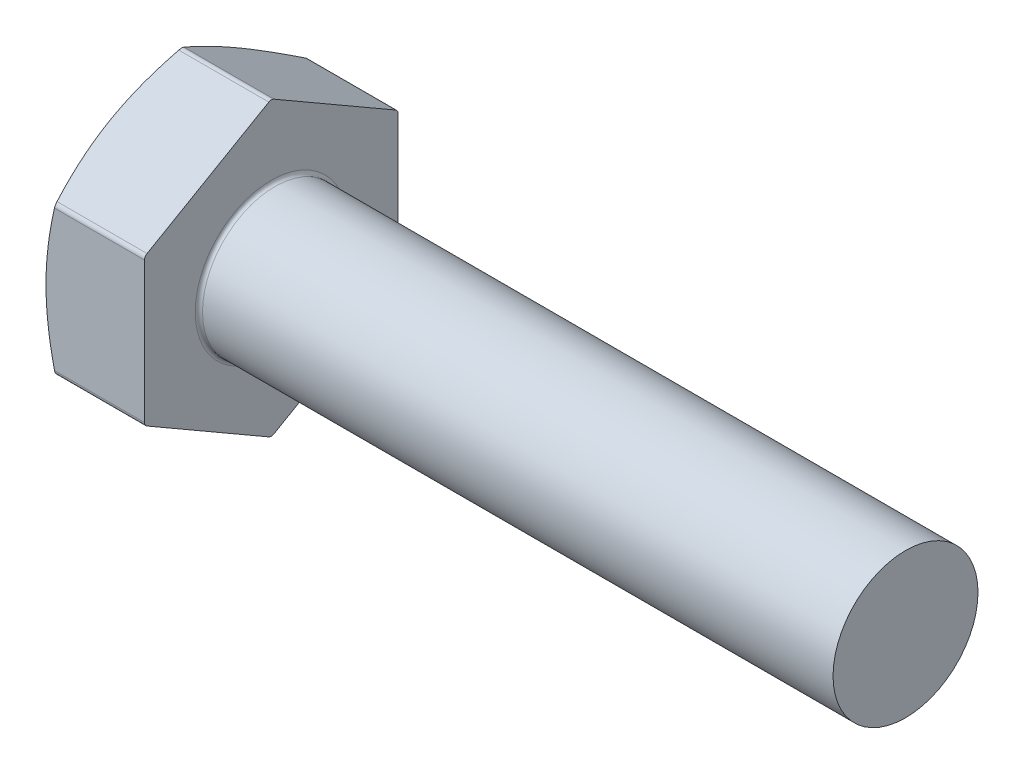
from build123d import *

# Parameters (mm, degrees)
SKETCH2_R           = 2
BOSS_EXTRUDE1_DEPTH = 60
BOSS_EXTRUDE2_DEPTH = 2.8
SKETCH5_OUTSIDE_W   = 33.75
SKETCH5_OUTSIDE_H   = 34.832
SKETCH5_OUTSIDE_R   = 3.325
CUT_EXTRUDE1_DEPTH  = 2.8
CUT_EXTRUDE1_DRAFT  = -65
FILLET7_R           = 0.14
CHAMFER1_SIZE       = 0.525
FILLET4_R           = 0.1
CUT_EXTRUDE2_START  = -42.5
SKETCH6_R           = 2
CUT_EXTRUDE2_DEPTH  = 42.5


with BuildPart() as part:
    # Sketch2 → Boss-Extrude1 (new body)
    with BuildSketch(Plane(origin=(0, 0, 0), x_dir=(0, 0, -1), z_dir=(1, 0, 0))):
        Circle(SKETCH2_R)
    extrude(amount=BOSS_EXTRUDE1_DEPTH)

    # Sketch3 → Boss-Extrude2 (add)
    with BuildSketch(Plane.ZY):
        Polygon((0, 4.041451884), (-3.5, 2.020725942), (-3.5, -2.020725942), (0, -4.041451884), (3.5, -2.020725942), (3.5, 2.020725942), align=None)
    extrude(amount=BOSS_EXTRUDE2_DEPTH)


with BuildPart() as cut_extrude1_tool:
    # Sketch5 outside → Cut-Extrude1 (with draft: the straight prism first)
    with BuildSketch(Plane.ZY.offset(2.8)):
        Rectangle(SKETCH5_OUTSIDE_W, SKETCH5_OUTSIDE_H)
        Circle(SKETCH5_OUTSIDE_R, mode=Mode.SUBTRACT)
    extrude(amount=-CUT_EXTRUDE1_DEPTH)
    # Cut-Extrude1: the draft: its side faces are tilted about the plane it starts from
    cut_extrude1_sides = [cut_extrude1_tool.faces().sort_by_distance(p)[0] for p in [
        (-1.4, -17.416, 0),
        (-1.4, 0, 16.875),
        (-1.4, 17.416, 0),
        (-1.4, 0, -16.875),
        (-1.4, 0, -3.325),
    ]]
    draft(cut_extrude1_sides, Plane.ZY.offset(2.8), CUT_EXTRUDE1_DRAFT)


with BuildPart() as part_1:
    add(part.part)

    # Cut-Extrude1: cut by cut_extrude1_tool
    add(cut_extrude1_tool.part, mode=Mode.SUBTRACT)

    # Fillet7
    fillet7_edges = [part_1.edges().sort_by_distance(p)[0] for p in [
        (-1.2329565, -4.041451884, 0),
        (-1.2329565, -2.020725942, -3.5),
        (-1.2329565, 2.020725942, -3.5),
        (-1.2329565, 4.041451884, 0),
        (-1.2329565, -2.020725942, 3.5),
        (-1.2329565, 2.020725942, 3.5),
    ]]
    fillet(fillet7_edges, radius=FILLET7_R)

    # Chamfer1
    chamfer1_edges = [part_1.edges().sort_by_distance(p)[0] for p in [
        (60, 0, 2),
    ]]
    chamfer(chamfer1_edges, length=CHAMFER1_SIZE)

    # Fillet4
    fillet4_edges = [part_1.edges().sort_by_distance(p)[0] for p in [
        (0, 0, 2),
    ]]
    fillet(fillet4_edges, radius=FILLET4_R)

    # Sketch6 → Cut-Extrude2 (cut)
    with BuildSketch(Plane(origin=(60, 0, 0), x_dir=(0, 0, -1), z_dir=(1, 0, 0)).offset(CUT_EXTRUDE2_START)):
        with Locations(Location((0, 0, 0), (0, 0, 180))):
            Circle(SKETCH6_R)
    extrude(amount=CUT_EXTRUDE2_DEPTH, mode=Mode.SUBTRACT)


solid = part_1.part
